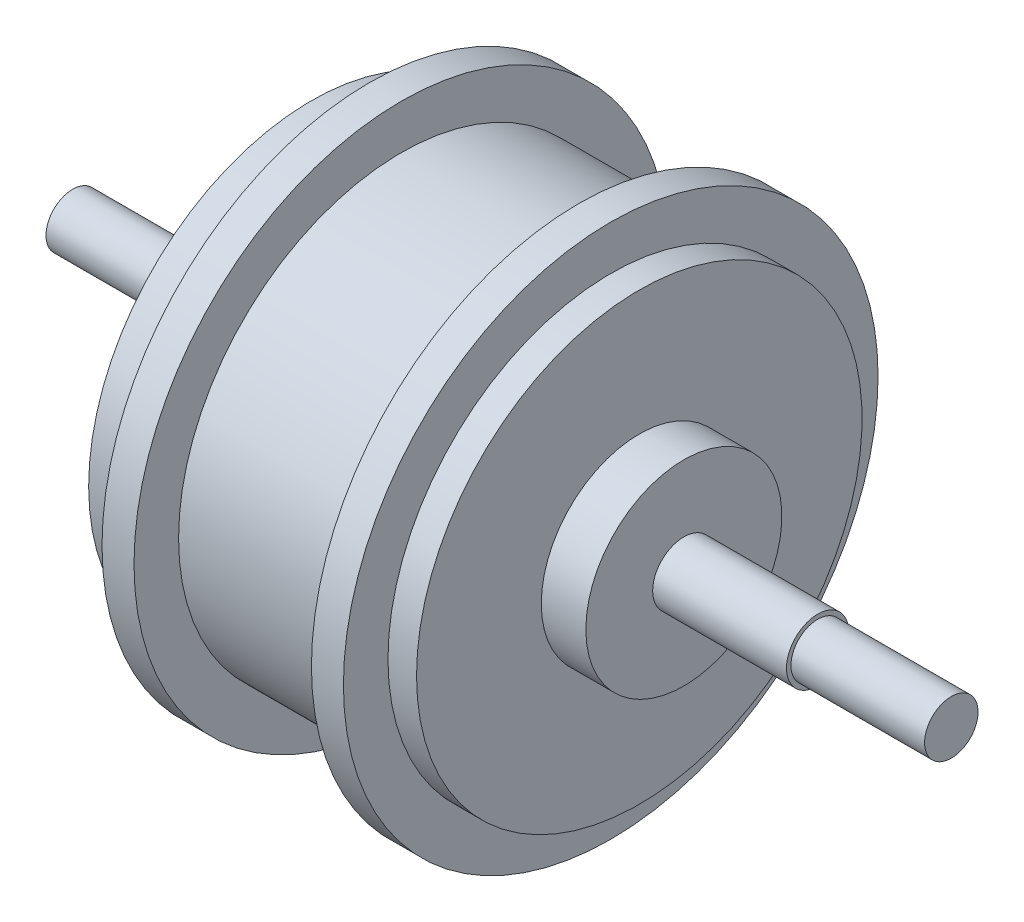
from build123d import *


with BuildPart() as part:
    # Sketch1 → Revolve1 (revolve)
    with BuildSketch(Plane.XY, mode=Mode.PRIVATE) as revolve1_sk:
        Polygon((0, 0), (0, 6), (33, 6), (33, 8.5), (43.5, 8.5), (43.5, 17), (49.814808066, 17), (49.814808066, 36.31855833), (53.568965517, 50), (66.568965517, 50), (66.568965517, 60), (73.751034483, 60), (73.751034483, 50), (113.568965517, 50), (113.568965517, 60), (120.751034483, 60), (120.751034483, 50), (127.16, 50), (127.16, 22), (137.16, 22), (137.16, 7), (167.191616728, 7), (167.191616728, 6), (197.191616728, 6), (197.191616728, 0), align=None)
    revolve(revolve1_sk.sketch.rotate(Axis((0, 0, 0), (1, 0, 0)), 90), axis=Axis((0, 0, 0), (1, 0, 0)))


solid = part.part
